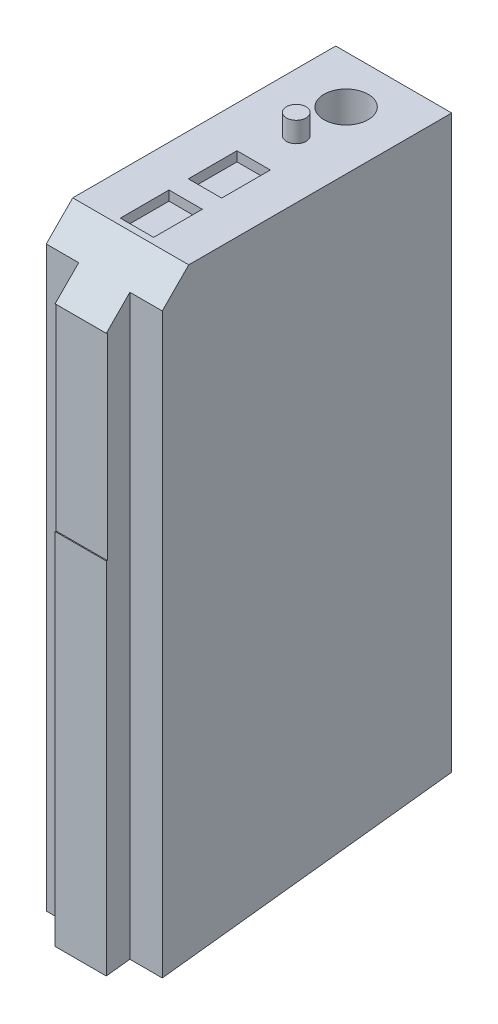
from build123d import *

# Parameters (mm, degrees)
SKETCH_1_W          = 54.45
SKETCH_1_H          = 10.46
SKETCH_1_H_2        = 107.75
EXTRUDE_1_DEPTH     = 24.02
CUT_EXTRUDE_1_DEPTH = 10
EXTRUDE_2_DEPTH     = 4.21
SKETCH_4_W          = 3.45
SKETCH_4_H          = 10.08
CUT_EXTRUDE_2_DEPTH = 2
SKETCH_5_W          = 6.71
SKETCH_5_H          = 4.88
CUT_EXTRUDE_4_DEPTH = 134.379468529
SKETCH_7_W          = 5.3
SKETCH_7_H          = 23.4
CUT_EXTRUDE_5_DEPTH = 0.2
SKETCH_8_W          = 10.6
SKETCH_8_H          = 9.42
CUT_EXTRUDE_6_DEPTH = 0.2
SKETCH_9_W          = 10.6
SKETCH_9_H          = 8
CUT_EXTRUDE_7_DEPTH = 0.2
SKETCH_10_W         = 6.68
SKETCH_10_H         = 5.61
CUT_EXTRUDE_8_DEPTH = 2.08


with BuildPart() as part:
    # 草图1 → 凸台-拉伸1 (new body)
    with BuildSketch(Plane(origin=(0, 0, 0), x_dir=(0, 0, -1), z_dir=(1, 0, 0))):
        with Locations((0, 53.875)):
            Rectangle(SKETCH_1_W, SKETCH_1_H)
        with Locations((0, -5.23)):
            Rectangle(SKETCH_1_W, SKETCH_1_H_2)
        Polygon((-37.585, -66.595), (27.225, -59.105), (-27.225, -59.105), (-27.225, 48.645), (-37.585, 48.645), align=None)
        Polygon((-27.225, 59.105), (-37.585, 48.645), (-27.225, 48.645), align=None)
    extrude(amount=EXTRUDE_1_DEPTH)

    # 草图2 → 切除-拉伸1 (cut)
    with BuildSketch(Plane(origin=(0, 59.105, 0), x_dir=(1, 0, 0), z_dir=(0, 1, 0))):
        with BuildLine():
            ThreePointArc((16.585, 17.36), (15.245013524, 20.595013524), (12.01, 21.935))
            Line((12.01, 21.935), (12.01, 12.785))
            ThreePointArc((12.01, 12.785), (15.245013524, 14.124986476), (16.585, 17.36))
        make_face()
        with BuildLine():
            Line((12.01, 12.785), (12.01, 21.935))
            ThreePointArc((12.01, 21.935), (7.435, 17.36), (12.01, 12.785))
        make_face()
    extrude(amount=-CUT_EXTRUDE_1_DEPTH, mode=Mode.SUBTRACT)

    # 草图3 → 凸台-拉伸2 (add)
    with BuildSketch(Plane(origin=(0, 59.105, 0), x_dir=(1, 0, 0), z_dir=(0, 1, 0))):
        with BuildLine():
            ThreePointArc((14.035, 7.04), (13.441891232, 8.471891232), (12.01, 9.065))
            Line((12.01, 9.065), (12.01, 5.015))
            ThreePointArc((12.01, 5.015), (13.441891232, 5.608108768), (14.035, 7.04))
        make_face()
        with BuildLine():
            Line((12.01, 5.015), (12.01, 9.065))
            ThreePointArc((12.01, 9.065), (9.985, 7.04), (12.01, 5.015))
        make_face()
    extrude(amount=EXTRUDE_2_DEPTH)

    # 草图4 → 切除-拉伸2 (cut)
    with BuildSketch(Plane(origin=(0, 59.105, 0), x_dir=(1, 0, 0), z_dir=(0, 1, 0))):
        with Locations((13.735, -6.815)):
            Rectangle(SKETCH_4_W, SKETCH_4_H)
        with Locations((10.285, -6.815)):
            Rectangle(SKETCH_4_W, SKETCH_4_H)
        with Locations((10.285, -20.895)):
            Rectangle(SKETCH_4_W, SKETCH_4_H)
        with Locations((13.735, -20.895)):
            Rectangle(SKETCH_4_W, SKETCH_4_H)
    extrude(amount=-CUT_EXTRUDE_2_DEPTH, mode=Mode.SUBTRACT)

    # 草图5 → 切除-拉伸4 (cut, through all)
    with BuildSketch(Plane(origin=(0, 59.105, 0), x_dir=(1, 0, 0), z_dir=(0, 1, 0))):
        with Locations((3.355, -35.145)):
            Rectangle(SKETCH_5_W, SKETCH_5_H)
        with Locations((20.665, -35.145)):
            Rectangle(SKETCH_5_W, SKETCH_5_H)
    extrude(amount=-CUT_EXTRUDE_4_DEPTH, mode=Mode.SUBTRACT)

    # 草图7 → 切除-拉伸5 (cut)
    with BuildSketch(Plane.XY.offset(37.585)):
        with Locations((9.36, 27.515)):
            Rectangle(SKETCH_7_W, SKETCH_7_H)
        with Locations((14.66, 27.515)):
            Rectangle(SKETCH_7_W, SKETCH_7_H)
    extrude(amount=-CUT_EXTRUDE_5_DEPTH, mode=Mode.SUBTRACT)

    # 草图8 → 切除-拉伸6 (cut)
    with BuildSketch(Plane.XY.offset(37.585)):
        with Locations((12.01, 43.925)):
            Rectangle(SKETCH_8_W, SKETCH_8_H)
    extrude(amount=-CUT_EXTRUDE_6_DEPTH, mode=Mode.SUBTRACT)

    # 草图9 → 切除-拉伸7 (cut)
    with BuildSketch(Plane.XY.offset(37.585)):
        with Locations((12.01, 11.815)):
            Rectangle(SKETCH_9_W, SKETCH_9_H)
    extrude(amount=-CUT_EXTRUDE_7_DEPTH, mode=Mode.SUBTRACT)

    # 草图10 → 切除-拉伸8 (cut)
    with BuildSketch(Plane.ZY):
        with Locations((18.195, 45.12)):
            Rectangle(SKETCH_10_W, SKETCH_10_H)
    extrude(amount=-CUT_EXTRUDE_8_DEPTH, mode=Mode.SUBTRACT)


solid = part.part
